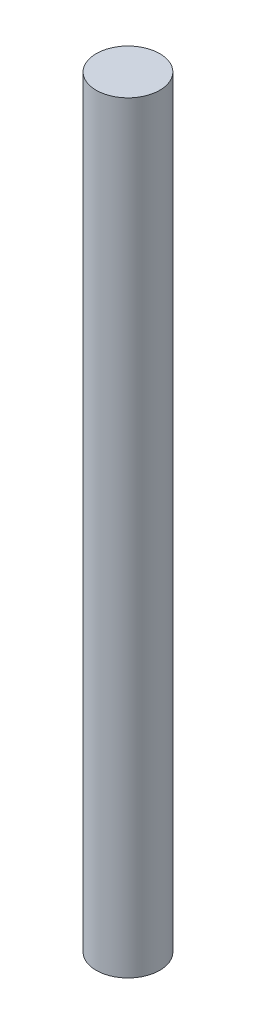
from build123d import *

# Parameters (mm, degrees)
SKETCH2_R           = 2.5
BOSS_EXTRUDE1_DEPTH = 60


with BuildPart() as part:
    # Sketch2 → Boss-Extrude1 (new body)
    with BuildSketch(Plane(origin=(0, 0, 0), x_dir=(1, 0, 0), z_dir=(0, 1, 0))):
        with Locations(Location((0, 0, 0), (0, 0, 270))):
            Circle(SKETCH2_R)
    extrude(amount=BOSS_EXTRUDE1_DEPTH)


solid = part.part
